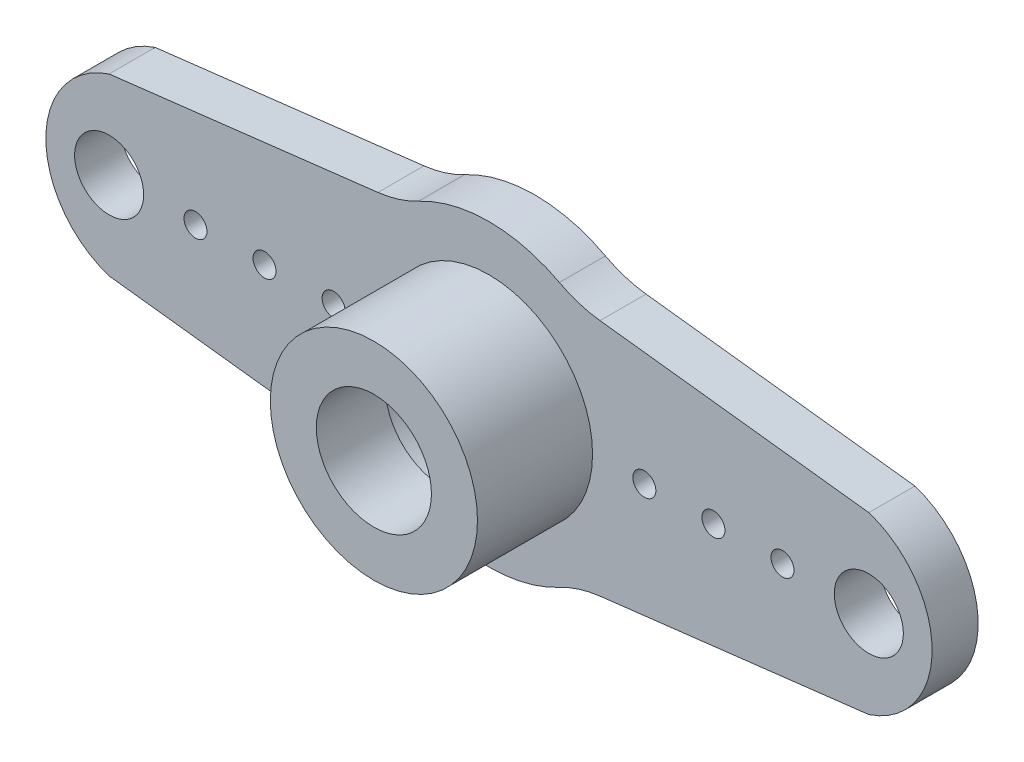
from build123d import *

# Parameters (mm, degrees)
SKETCH_1_R          = 0.5
EXTRUDE_1_DEPTH     = 2
SKETCH_2_R          = 4.5
SKETCH_2_R_2        = 2.5
EXTRUDE_2_DEPTH     = 5
SKETCH_3_R          = 3.5
CUT_EXTRUDE_1_DEPTH = 4
SKETCH_5_R          = 1.5
CUT_EXTRUDE_2_DEPTH = 10


with BuildPart() as part:
    # 草图1 → 凸台-拉伸1 (new body)
    with BuildSketch(Plane.XY):
        with BuildLine():
            Line((16.5, -3.799671038), (4.823155871, -5.182135299))
            ThreePointArc((4.823155871, -5.182135299), (3.914969309, -5.376520098), (3.058401724, -5.735519061))
            ThreePointArc((3.058401724, -5.735519061), (0, -6.5), (-3.058401724, -5.735519061))
            ThreePointArc((-3.058401724, -5.735519061), (-3.914969309, -5.376520098), (-4.823155871, -5.182135299))
            Line((-4.823155871, -5.182135299), (-16.5, -3.799671038))
            ThreePointArc((-16.5, -3.799671038), (-19.25, 0), (-16.5, 3.799671038))
            Line((-16.5, 3.799671038), (-4.823155871, 5.182135299))
            ThreePointArc((-4.823155871, 5.182135299), (-3.914969309, 5.376520098), (-3.058401724, 5.735519061))
            ThreePointArc((-3.058401724, 5.735519061), (0, 6.5), (3.058401724, 5.735519061))
            ThreePointArc((3.058401724, 5.735519061), (3.914969309, 5.376520098), (4.823155871, 5.182135299))
            Line((4.823155871, 5.182135299), (16.5, 3.799671038))
            ThreePointArc((16.5, 3.799671038), (19.25, 0), (16.5, -3.799671038))
        make_face()
        with Locations((-16.5, 0)):
            Circle(SKETCH_1_R, mode=Mode.SUBTRACT)
        with Locations((-12.75, 0)):
            Circle(SKETCH_1_R, mode=Mode.SUBTRACT)
        with Locations((-9.75, 0)):
            Circle(SKETCH_1_R, mode=Mode.SUBTRACT)
        with Locations((-6.75, 0)):
            Circle(SKETCH_1_R, mode=Mode.SUBTRACT)
        with Locations((-3.75, 0)):
            Circle(SKETCH_1_R, mode=Mode.SUBTRACT)
        with Locations(Location((3.75, 0, 0), (0, 0, 180))):
            Circle(SKETCH_1_R, mode=Mode.SUBTRACT)
        with Locations(Location((6.75, 0, 0), (0, 0, 180))):
            Circle(SKETCH_1_R, mode=Mode.SUBTRACT)
        with Locations(Location((9.75, 0, 0), (0, 0, 180))):
            Circle(SKETCH_1_R, mode=Mode.SUBTRACT)
        with Locations(Location((12.75, 0, 0), (0, 0, 180))):
            Circle(SKETCH_1_R, mode=Mode.SUBTRACT)
        with Locations(Location((16.5, 0, 0), (0, 0, 180))):
            Circle(SKETCH_1_R, mode=Mode.SUBTRACT)
    extrude(amount=EXTRUDE_1_DEPTH)

    # 草图2 → 凸台-拉伸2 (add)
    with BuildSketch(Plane.XY.offset(2)):
        Circle(SKETCH_2_R)
        Circle(SKETCH_2_R_2, mode=Mode.SUBTRACT)
    extrude(amount=EXTRUDE_2_DEPTH)

    # 草图3 → 切除-拉伸1 (cut)
    with BuildSketch(Plane(origin=(0, 0, 0), x_dir=(-1, 0, 0), z_dir=(0, 0, -1))):
        Circle(SKETCH_3_R)
    extrude(amount=-CUT_EXTRUDE_1_DEPTH, mode=Mode.SUBTRACT)

    # 草图5 → 切除-拉伸2 (cut)
    with BuildSketch(Plane.XY.offset(2)):
        with Locations((16.5, 0)):
            Circle(SKETCH_5_R)
        with Locations((-16.5, 0)):
            Circle(SKETCH_5_R)
    extrude(amount=-CUT_EXTRUDE_2_DEPTH, mode=Mode.SUBTRACT)


solid = part.part
